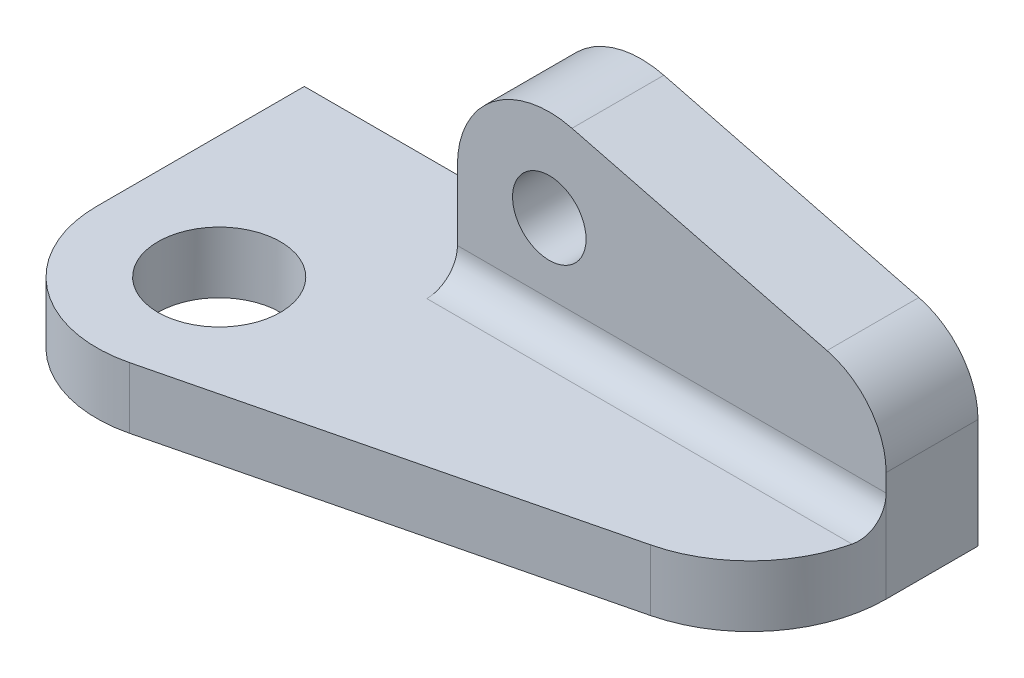
from build123d import *

# Parameters (mm, degrees)
BOSS_EXTRUDE1_DEPTH        = 10
BOSS_EXTRUDE2_DEPTH        = 15
F_20_0_20_DIAMETER_HOLE1_D = 20
F_12_0_12_DIAMETER_HOLE1_D = 12
FILLET1_R                  = 5


with BuildPart() as part:
    # Sketch2 → Boss-Extrude1 (new body)
    with BuildSketch(Plane(origin=(0, 0, 0), x_dir=(1, 0, 0), z_dir=(0, 1, 0))):
        with BuildLine():
            Line((0, 0), (110, 0))
            Line((110, 0), (110, -15))
            ThreePointArc((110, -15), (105.270148503, -28.695601287), (93.096662434, -36.553541647))
            Line((93.096662434, -36.553541647), (24.767095445, -53.323563036))
            ThreePointArc((24.767095445, -53.323563036), (7.657834649, -49.637565074), (0, -33.9))
            Line((0, -33.9), (0, 0))
        make_face()
    extrude(amount=BOSS_EXTRUDE1_DEPTH)

    # Sketch4 → Boss-Extrude2 (add)
    with BuildSketch(Plane(origin=(0, 0, 0), x_dir=(-1, 0, 0), z_dir=(0, 0, -1))):
        with BuildLine():
            Line((-110, 10), (-40, 10))
            Line((-40, 10), (-40, 26.4))
            ThreePointArc((-40, 26.4), (-45.795793145, 38.24409457), (-58.70434349, 40.935399523))
            Line((-58.70434349, 40.935399523), (-100.345866401, 30.323066228))
            ThreePointArc((-100.345866401, 30.323066228), (-107.302721394, 25.766620463), (-110, 17.9))
            Line((-110, 17.9), (-110, 10))
        make_face()
    extrude(amount=-BOSS_EXTRUDE2_DEPTH)

    # Ø20.0 (20) Diameter Hole1 (through all)
    with Locations(Plane(origin=(20, 10, 33.9), x_dir=(0, 0, 1), z_dir=(0, 1, 0))):
        with Locations((0, 0)):
            Hole(F_20_0_20_DIAMETER_HOLE1_D / 2)

    # Ø12.0 (12) Diameter Hole1 (through all)
    with Locations(Plane(origin=(55, 26.4, 15), x_dir=(1, 0, 0), z_dir=(0, 0, 1))):
        with Locations((0, 0)):
            Hole(F_12_0_12_DIAMETER_HOLE1_D / 2)

    # Fillet1
    fillet1_edges = [part.edges().sort_by_distance(p)[0] for p in [
        (75, 10, 15),
    ]]
    fillet(fillet1_edges, radius=FILLET1_R)


solid = part.part
